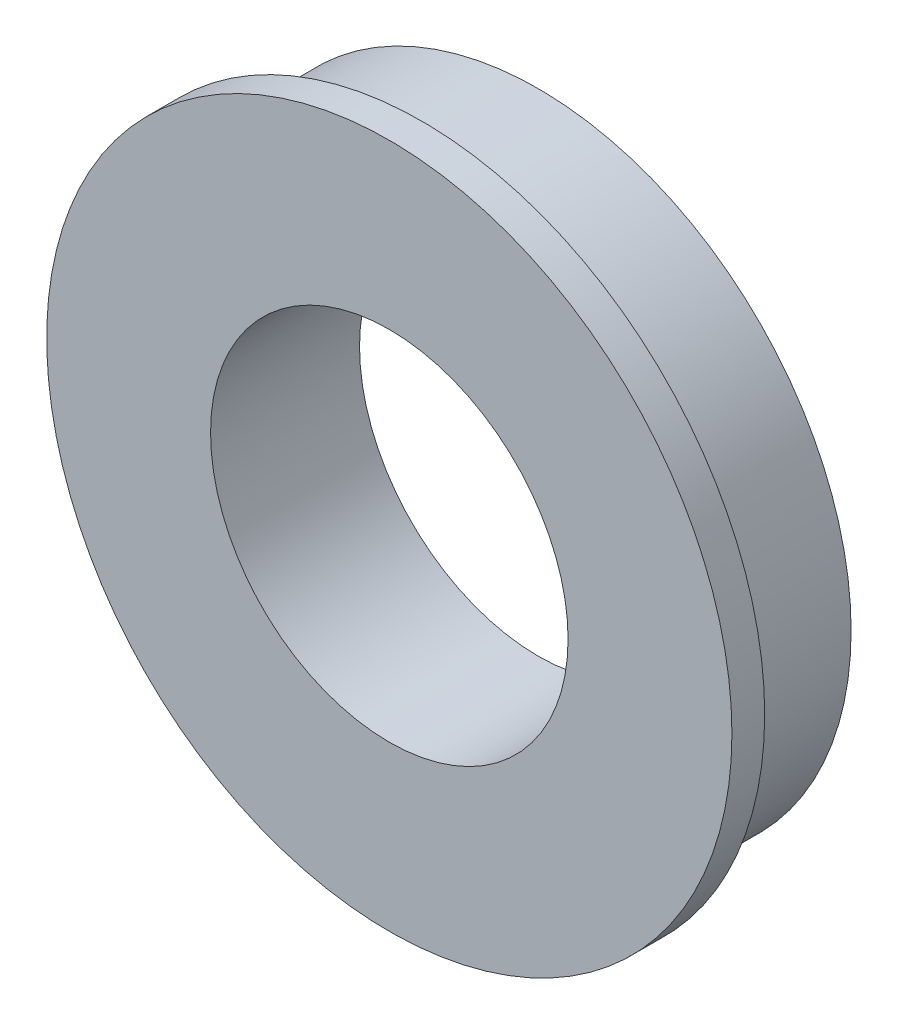
from build123d import *


with BuildPart() as part:
    # Sketch1 → Revolve1 (revolve)
    with BuildSketch(Plane(origin=(0, 0, 0), x_dir=(0, 0, -1), z_dir=(1, 0, 0)), mode=Mode.PRIVATE) as revolve1_sk:
        Polygon((0, 6), (5, 6), (5, 10.5), (1.1, 10.5), (1.1, 11.5), (0, 11.5), align=None)
    revolve(revolve1_sk.sketch.rotate(Axis((0, 0, 0), (0, 0, -1)), 90), axis=Axis((0, 0, 0), (0, 0, -1)))


solid = part.part
